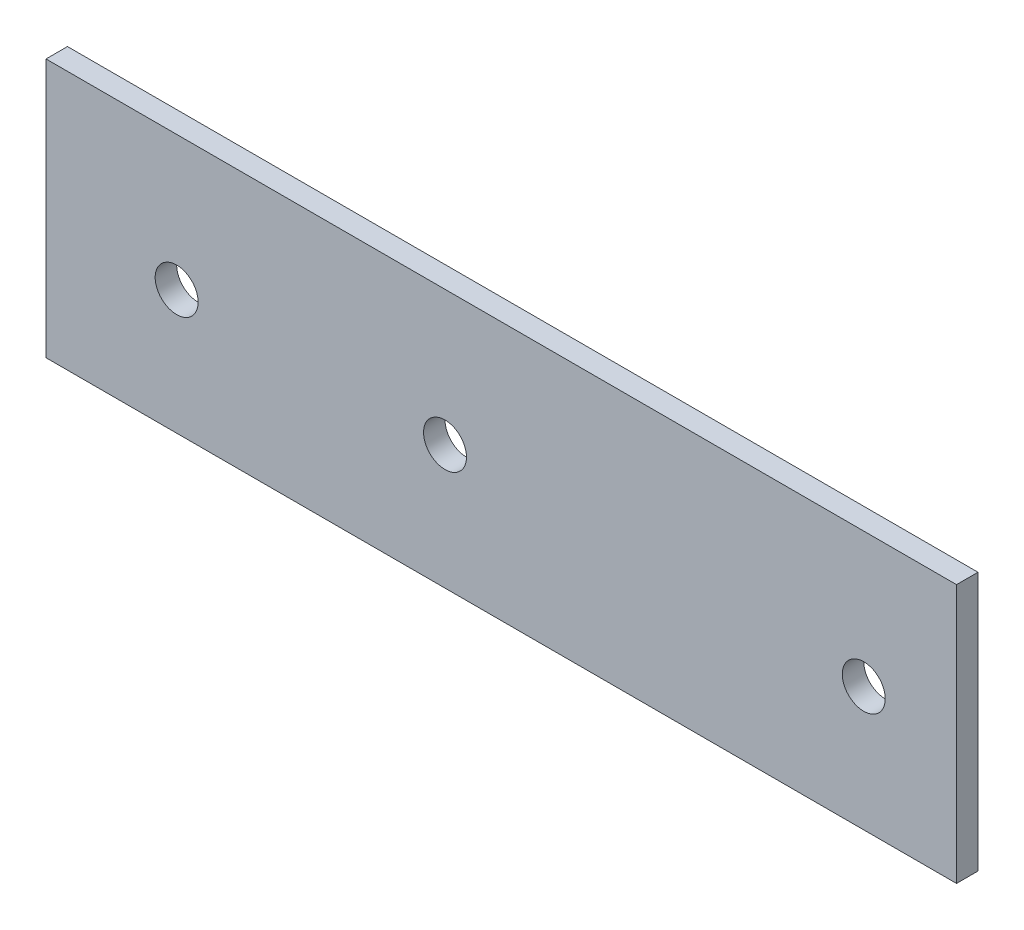
from build123d import *

# Parameters (mm, degrees)
SKETCH1_W           = 134.633276231
SKETCH1_H           = 38.266277503
SKETCH1_R           = 3.175
BOSS_EXTRUDE1_DEPTH = 3.175


with BuildPart() as part:
    # Sketch1 → Boss-Extrude1 (new body)
    with BuildSketch(Plane.XY):
        with Locations((22.598649827, 0.771501565)):
            Rectangle(SKETCH1_W, SKETCH1_H)
        with Locations((-25.4, 0)):
            Circle(SKETCH1_R, mode=Mode.SUBTRACT)
        with Locations((76.2, 0)):
            Circle(SKETCH1_R, mode=Mode.SUBTRACT)
        with Locations((14.280741375, 0)):
            Circle(SKETCH1_R, mode=Mode.SUBTRACT)
    extrude(amount=BOSS_EXTRUDE1_DEPTH)


solid = part.part
